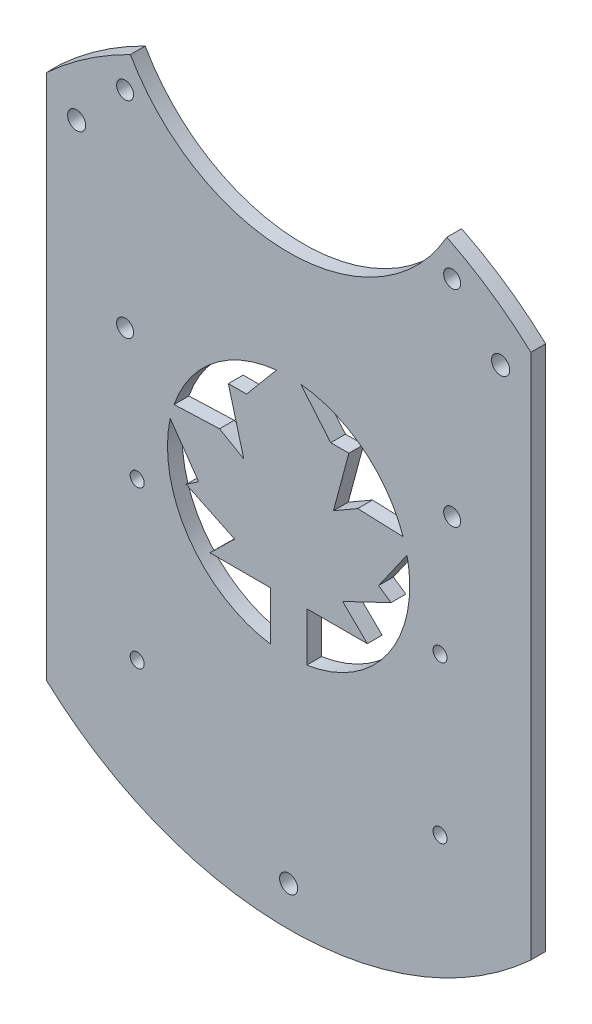
from build123d import *

# Parameters (mm, degrees)
SKETCH1_R           = 1.89865
BOSS_EXTRUDE3_DEPTH = 3.0988
SKETCH2_R           = 1.4732
CUT_EXTRUDE1_DEPTH  = 3.0988
CUT_EXTRUDE2_DEPTH  = 3.0988
SKETCH4_R           = 1.778
CUT_EXTRUDE3_DEPTH  = 3.0988


with BuildPart() as part:
    # Sketch1 → Boss-Extrude3 (new body)
    with BuildSketch(Plane.XY):
        with BuildLine():
            Line((-50.8, 55.175719298), (-50.8, -55.175719298))
            ThreePointArc((-50.8, -55.175719298), (0, -75), (50.8, -55.175719298))
            Line((50.8, -55.175719298), (50.8, 55.175719298))
            ThreePointArc((50.8, 55.175719298), (42.419210034, 61.851520758), (33.172661219, 67.264957799))
            ThreePointArc((33.172661219, 67.264957799), (0, 47.904876359), (-33.172661219, 67.264957799))
            ThreePointArc((-33.172661219, 67.264957799), (-42.419210034, 61.851520758), (-50.8, 55.175719298))
        make_face()
        with Locations((0, -66.675)):
            Circle(SKETCH1_R, mode=Mode.SUBTRACT)
        with Locations((-44.45, 49.6966108)):
            Circle(SKETCH1_R, mode=Mode.SUBTRACT)
        with Locations(Location((44.45, 49.6966108, 0), (0, 0, 180))):
            Circle(SKETCH1_R, mode=Mode.SUBTRACT)
    extrude(amount=BOSS_EXTRUDE3_DEPTH)

    # Sketch2 → Cut-Extrude1 (cut)
    with BuildSketch(Plane.XY.offset(3.0988)):
        with Locations((-31.75, -41.98)):
            Circle(SKETCH2_R)
        with Locations((31.75, -41.98)):
            Circle(SKETCH2_R)
        with Locations((-31.75, -9.1251)):
            Circle(SKETCH2_R)
        with Locations((31.75, -9.1251)):
            Circle(SKETCH2_R)
    extrude(amount=-CUT_EXTRUDE1_DEPTH, mode=Mode.SUBTRACT)

    # Sketch3 → Cut-Extrude2 (cut)
    with BuildSketch(Plane.XY.offset(3.0988)):
        with BuildLine():
            Line((8.827105782, 17.78), (2.54, 25.272680903))
            ThreePointArc((2.54, 25.272680903), (15.758317518, 19.920728626), (24.009298775, 8.289365013))
            Line((24.009298775, 8.289365013), (14.484298775, 8.647939367))
            Line((14.484298775, 8.647939367), (9.404298775, 5.715))
            Line((9.404298775, 5.715), (12.637105782, 17.78))
            Line((12.637105782, 17.78), (8.827105782, 17.78))
        make_face()
        with BuildLine():
            Line((18.868143133, -3.140634987), (24.826209076, 5.368365013))
            ThreePointArc((24.826209076, 5.368365013), (20.911260009, -14.418016674), (3.81, -25.112624315))
            Line((3.81, -25.112624315), (3.81, -14.877877919))
            Line((3.81, -14.877877919), (16.51, -14.877877919))
            Line((16.51, -14.877877919), (11.327081569, -9.797877919))
            Line((11.327081569, -9.797877919), (21.487081569, -4.935568543))
            Line((21.487081569, -4.935568543), (18.868143133, -3.140634987))
        make_face()
        with BuildLine():
            Line((-3.81, -14.877877919), (-3.81, -25.112624315))
            ThreePointArc((-3.81, -25.112624315), (-20.911260009, -14.418016674), (-24.826209076, 5.368365013))
            Line((-24.826209076, 5.368365013), (-18.868143133, -3.140634987))
            Line((-18.868143133, -3.140634987), (-21.487081569, -4.935568543))
            Line((-21.487081569, -4.935568543), (-11.327081569, -9.797877919))
            Line((-11.327081569, -9.797877919), (-16.51, -14.877877919))
            Line((-16.51, -14.877877919), (-3.81, -14.877877919))
        make_face()
        with BuildLine():
            Line((-14.484298775, 8.647939367), (-24.009298775, 8.289365013))
            ThreePointArc((-24.009298775, 8.289365013), (-15.758317518, 19.920728626), (-2.54, 25.272680903))
            Line((-2.54, 25.272680903), (-8.827105782, 17.78))
            Line((-8.827105782, 17.78), (-12.637105782, 17.78))
            Line((-12.637105782, 17.78), (-9.404298775, 5.715))
            Line((-9.404298775, 5.715), (-14.484298775, 8.647939367))
        make_face()
    extrude(amount=-CUT_EXTRUDE2_DEPTH, mode=Mode.SUBTRACT)

    # Sketch4 → Cut-Extrude3 (cut)
    with BuildSketch(Plane.XY.offset(3.0988)):
        with Locations((-34.29, 60.279957799)):
            Circle(SKETCH4_R)
        with Locations((34.29, 60.279957799)):
            Circle(SKETCH4_R)
        with Locations((34.29, 17.099957799)):
            Circle(SKETCH4_R)
        with Locations((-34.29, 17.099957799)):
            Circle(SKETCH4_R)
    extrude(amount=-CUT_EXTRUDE3_DEPTH, mode=Mode.SUBTRACT)


solid = part.part
